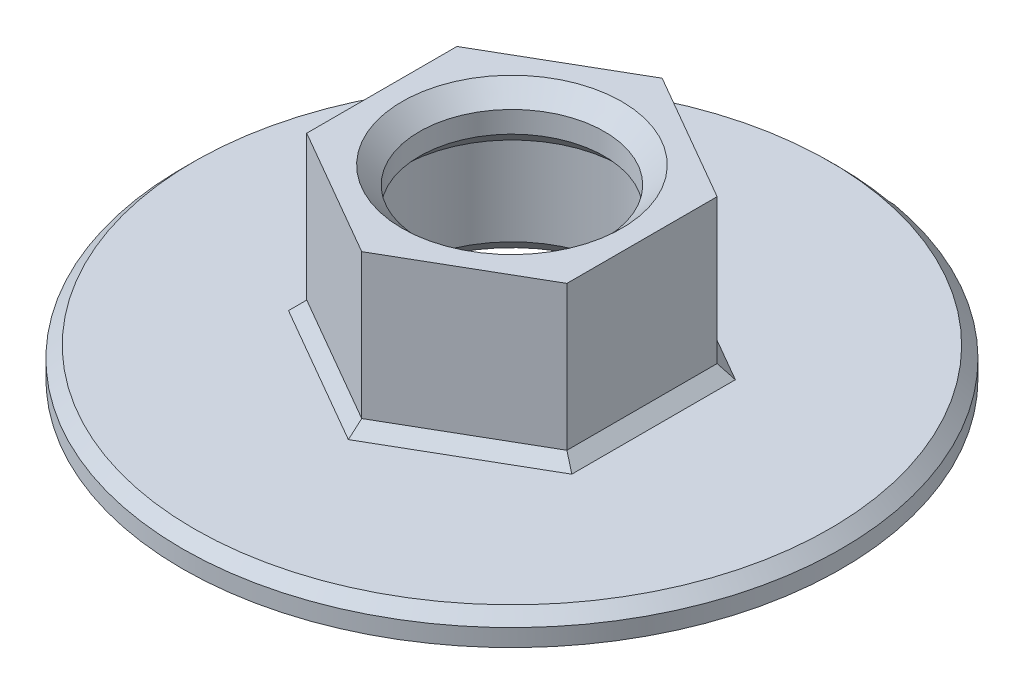
from build123d import *

# Parameters (mm, degrees)
SKETCH1_R                       = 27
SKETCH1_R_2                     = 9.675
BOSS_EXTRUDE1_DEPTH             = 0.6
SKETCH2_R                       = 9.675
BOSS_EXTRUDE2_DEPTH             = 13.5
SKETCH3_R                       = 10.043523413
SKETCH3_R_2                     = 8
BOSS_EXTRUDE3_DEPTH             = 4.85
CHAMFER1_SIZE                   = 1.5
SKETCH4_R                       = 28.5
SKETCH4_R_2                     = 25
BOSS_EXTRUDE4_DEPTH             = 1.9
BOSS_EXTRUDE4_DIRECTION_2_REACH = 42.704
CHAMFER2_SIZE                   = 1
CHAMFER3_SIZE                   = 1
CUT_EXTRUDE1_DEPTH              = 8.4


with BuildPart() as part:
    # Sketch1 → Boss-Extrude1 (new body)
    with BuildSketch(Plane(origin=(0, 0, 0), x_dir=(1, 0, 0), z_dir=(0, 1, 0))):
        with Locations(Location((0, 0, 0), (0, 0, 270))):
            Circle(SKETCH1_R)
        with Locations(Location((0, 0, 0), (0, 0, 270))):
            Circle(SKETCH1_R_2, mode=Mode.SUBTRACT)
    extrude(amount=BOSS_EXTRUDE1_DEPTH)

    # Sketch2 → Boss-Extrude2 (add)
    with BuildSketch(Plane(origin=(0, 0.6, 0), x_dir=(1, 0, 0), z_dir=(0, 1, 0))):
        Polygon((0, 12.990381057), (-11.25, 6.495190528), (-11.25, -6.495190528), (0, -12.990381057), (11.25, -6.495190528), (11.25, 6.495190528), align=None)
        with Locations(Location((0, 0, 0), (0, 0, 270))):
            Circle(SKETCH2_R, mode=Mode.SUBTRACT)
    extrude(amount=BOSS_EXTRUDE2_DEPTH)

    # Sketch3 → Boss-Extrude3 (add)
    with BuildSketch(Plane(origin=(0, 14.1, 0), x_dir=(1, 0, 0), z_dir=(0, 1, 0))):
        Circle(SKETCH3_R)
        with Locations(Location((0, 0, 0), (0, 0, 270))):
            Circle(SKETCH3_R_2, mode=Mode.SUBTRACT)
    extrude(amount=-BOSS_EXTRUDE3_DEPTH)

    # Chamfer1
    chamfer1_edges = [part.edges().sort_by_distance(p)[0] for p in [
        (0, 9.25, -8),
        (0, 14.1, -8),
        (0, 0, -9.675),
    ]]
    chamfer(chamfer1_edges, length=CHAMFER1_SIZE)

    # Sketch4 → Boss-Extrude4 (add)
    with BuildSketch(Plane.XZ):
        with Locations(Location((0, 0, 0), (0, 0, 270))):
            Circle(SKETCH4_R)
        with Locations(Location((0, 0, 0), (0, 0, 270))):
            Circle(SKETCH4_R_2, mode=Mode.SUBTRACT)
    extrude(amount=BOSS_EXTRUDE4_DEPTH)

    # Boss-Extrude4 direction 2: up to this face of the body (flat: up to its plane)
    boss_extrude4_direction_2_end = Plane(part.part.faces().sort_by_distance((0, 0.6, -26.236324676))[0])
    # Sketch4 → Boss-Extrude4 direction 2 (add, up to the picked face)
    with BuildSketch(Plane.XZ, mode=Mode.PRIVATE) as boss_extrude4_direction_2_sk1:
        with Locations(Location((0, 0, 0), (0, 0, 270))):
            Circle(SKETCH4_R)
        with Locations(Location((0, 0, 0), (0, 0, 270))):
            Circle(SKETCH4_R_2, mode=Mode.SUBTRACT)
    boss_extrude4_direction_2_tool1 = split(extrude(boss_extrude4_direction_2_sk1.sketch, amount=-BOSS_EXTRUDE4_DIRECTION_2_REACH, mode=Mode.PRIVATE), bisect_by=boss_extrude4_direction_2_end, keep=Keep.BOTH, mode=Mode.PRIVATE)
    add(boss_extrude4_direction_2_tool1.solids().sort_by(Axis((0, 0, 27.693898), (0, 1, 0)))[0])

    # Chamfer2
    chamfer2_edges = [part.edges().sort_by_distance(p)[0] for p in [
        (0, 0.6, 28.5),
    ]]
    chamfer(chamfer2_edges, length=CHAMFER2_SIZE)

    # Chamfer3
    chamfer3_edges = [part.edges().sort_by_distance(p)[0] for p in [
        (5.625, 0.6, -9.742785793),
        (-5.625, 0.6, -9.742785793),
        (-11.25, 0.6, 0),
        (-5.625, 0.6, 9.742785793),
        (5.625, 0.6, 9.742785793),
        (11.25, 0.6, 0),
    ]]
    chamfer(chamfer3_edges, length=CHAMFER3_SIZE)

    # Sketch5 → Cut-Extrude1 (cut)
    with BuildSketch(Plane(origin=(0, 0, 0), x_dir=(1, 0, 0), z_dir=(0, 1, 0))):
        with BuildLine():
            ThreePointArc((3.336791258, 24.776315789), (0, 33.5), (-3.336791258, 24.776315789))
            ThreePointArc((-3.336791258, 24.776315789), (0, 25), (3.336791258, 24.776315789))
        make_face()
    extrude(amount=-CUT_EXTRUDE1_DEPTH, mode=Mode.SUBTRACT)


solid = part.part
